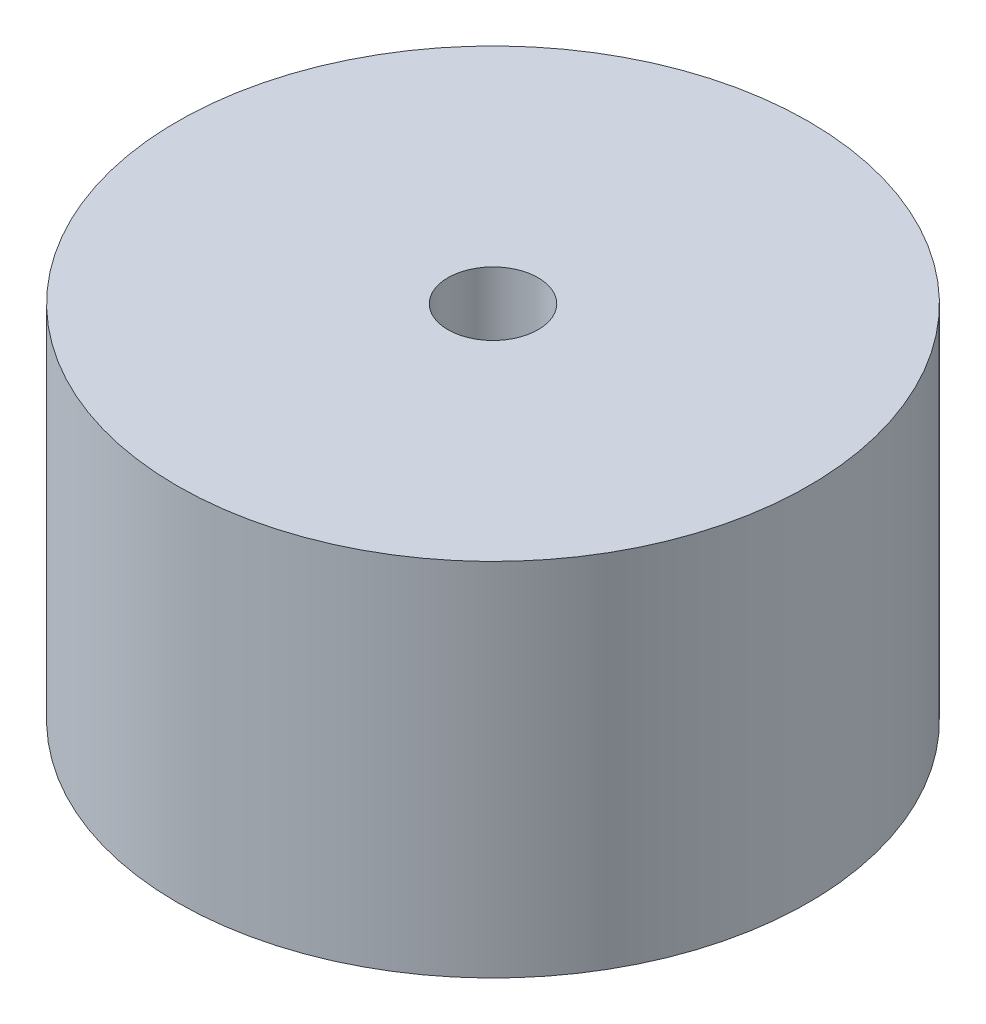
from build123d import *

# Parameters (mm, degrees)
SKETCH1_R           = 22.225
SKETCH1_R_2         = 3.175
INJECTOR_HEAD_DEPTH = 25.4


with BuildPart() as part:
    # Sketch1 → Injector Head (new body)
    with BuildSketch(Plane(origin=(0, 0, 0), x_dir=(1, 0, 0), z_dir=(0, 1, 0))):
        Circle(SKETCH1_R)
        Circle(SKETCH1_R_2, mode=Mode.SUBTRACT)
    extrude(amount=-INJECTOR_HEAD_DEPTH)


solid = part.part
